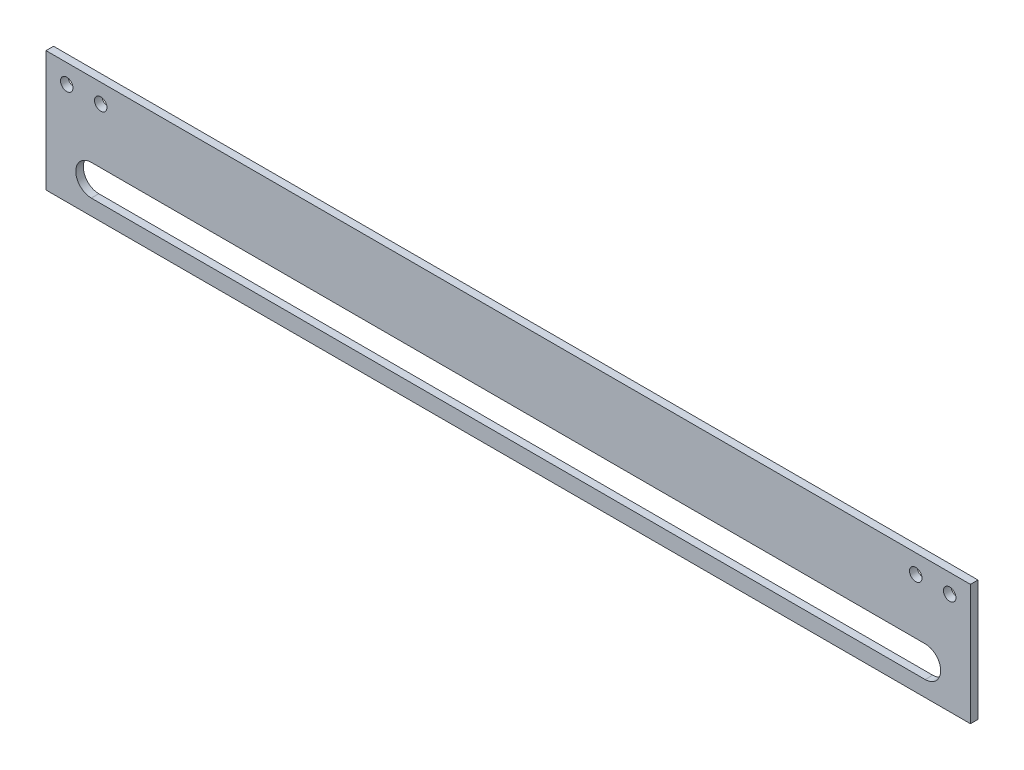
from build123d import *

# Parameters (mm, degrees)
SKETCH_1_W      = 245
SKETCH_1_H      = 32
SKETCH_1_R      = 1.65
EXTRUDE_1_DEPTH = 2


with BuildPart() as part:
    # 草图1 → 凸台-拉伸1 (new body)
    with BuildSketch(Plane.XY):
        with Locations((122.5, 16)):
            Rectangle(SKETCH_1_W, SKETCH_1_H)
        with Locations((14.5, 27)):
            Circle(SKETCH_1_R, mode=Mode.SUBTRACT)
        with Locations((5.5, 27)):
            Circle(SKETCH_1_R, mode=Mode.SUBTRACT)
        with Locations((230.5, 27)):
            Circle(SKETCH_1_R, mode=Mode.SUBTRACT)
        with Locations((239.5, 27)):
            Circle(SKETCH_1_R, mode=Mode.SUBTRACT)
        with BuildLine():
            Line((12, 12.35), (233, 12.35))
            ThreePointArc((233, 12.35), (237.1, 8.25), (233, 4.15))
            Line((233, 4.15), (12, 4.15))
            ThreePointArc((12, 4.15), (7.9, 8.25), (12, 12.35))
        make_face(mode=Mode.SUBTRACT)
    extrude(amount=EXTRUDE_1_DEPTH)


solid = part.part
